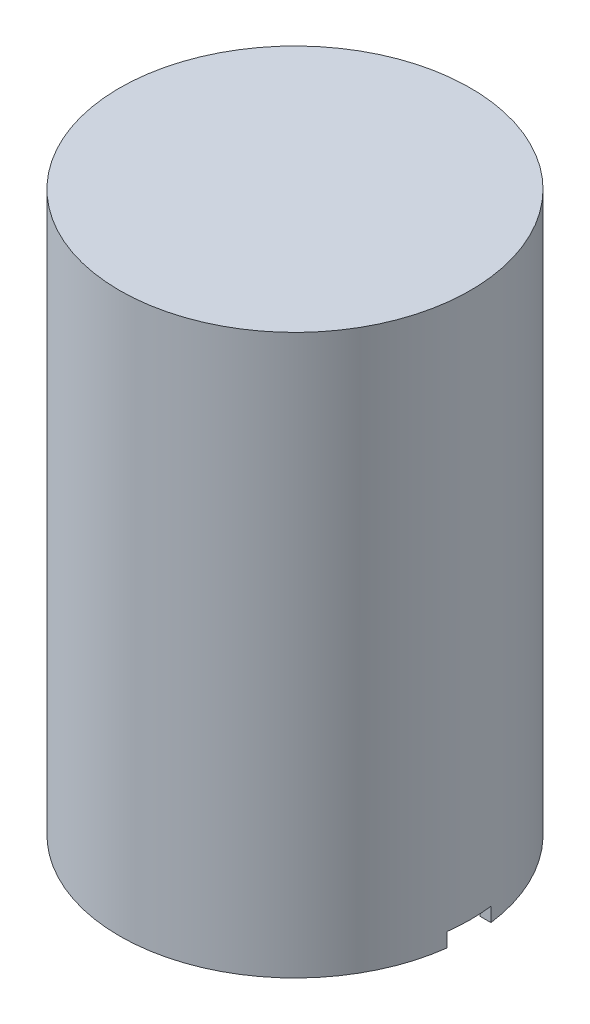
from build123d import *

# Parameters (mm, degrees)
SKETCH1_R               = 32
BOSS_EXTRUDE1_DEPTH     = 100
SKETCH2_R               = 30.025
CUT_EXTRUDE1_DEPTH      = 59
SKETCH3_R               = 32
BOSS_EXTRUDE2_DEPTH     = 2
CUT_EXTRUDE2_DEPTH      = 4
CUT_EXTRUDE2_DEPTH_BACK = 4
SKETCH4_W               = 70.13553728
SKETCH4_H               = 5.843920962


with BuildPart() as part:
    # Sketch1 → Boss-Extrude1 (new body)
    with BuildSketch(Plane(origin=(0, 0, 0), x_dir=(1, 0, 0), z_dir=(0, 1, 0))):
        Circle(SKETCH1_R)
    extrude(amount=BOSS_EXTRUDE1_DEPTH)

    # Sketch2 → Cut-Extrude1 (cut)
    with BuildSketch(Plane.XZ):
        Circle(SKETCH2_R)
    extrude(amount=-CUT_EXTRUDE1_DEPTH, mode=Mode.SUBTRACT)

    # Sketch3 → Boss-Extrude2 (add)
    with BuildSketch(Plane(origin=(0, 100, 0), x_dir=(1, 0, 0), z_dir=(0, 1, 0))):
        Circle(SKETCH3_R)
    extrude(amount=BOSS_EXTRUDE2_DEPTH)

    # Sketch4 → Cut-Extrude2 (cut, two sides: drawn at the far end of the back side and taken through both)
    with BuildSketch(Plane.XY.offset(-CUT_EXTRUDE2_DEPTH_BACK)):
        with Locations((-0.197032679, -0.331379703)):
            Rectangle(SKETCH4_W, SKETCH4_H)
    extrude(amount=CUT_EXTRUDE2_DEPTH + CUT_EXTRUDE2_DEPTH_BACK, mode=Mode.SUBTRACT)


solid = part.part
